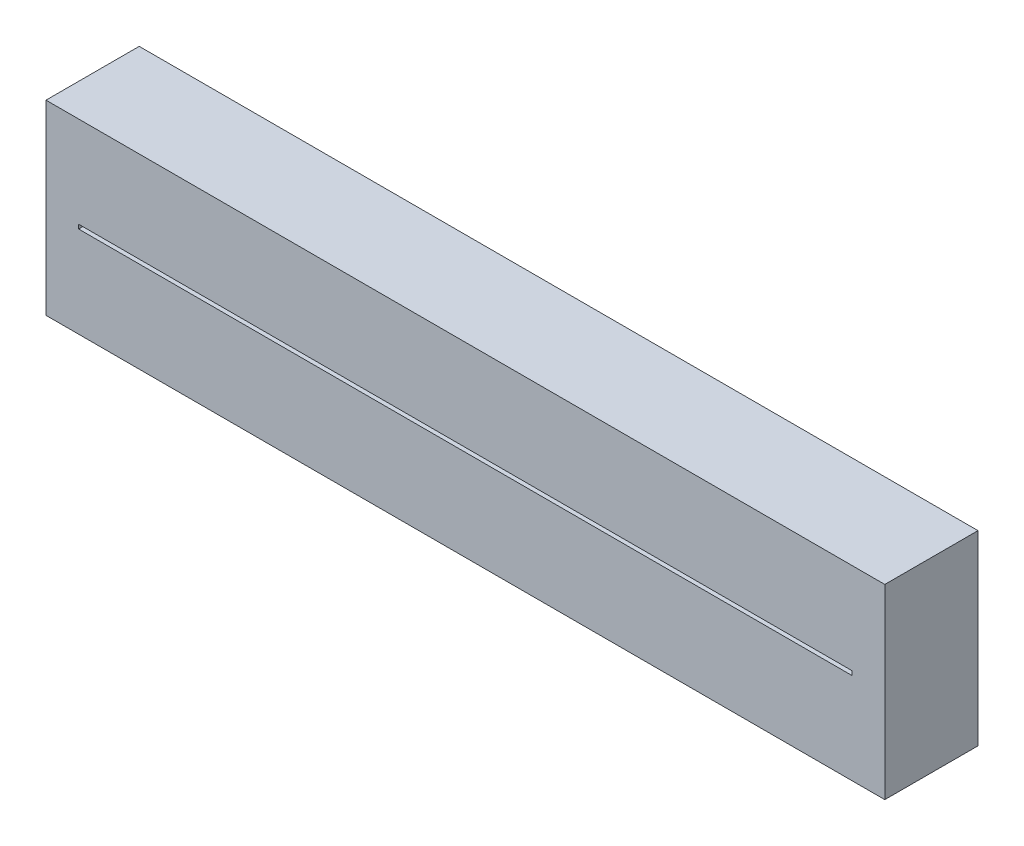
from build123d import *

# Parameters (mm, degrees)
SKETCH1_W           = 90
SKETCH1_H           = 20
BOSS_EXTRUDE1_DEPTH = 10
SKETCH2_W           = 83
SKETCH2_H           = 0.45
CUT_EXTRUDE1_DEPTH  = 5


with BuildPart() as part:
    # Sketch1 → Boss-Extrude1 (new body)
    with BuildSketch(Plane.XY):
        Rectangle(SKETCH1_W, SKETCH1_H)
    extrude(amount=BOSS_EXTRUDE1_DEPTH)

    # Sketch2 → Cut-Extrude1 (cut)
    with BuildSketch(Plane.XY.offset(10)):
        Rectangle(SKETCH2_W, SKETCH2_H)
    extrude(amount=-CUT_EXTRUDE1_DEPTH, mode=Mode.SUBTRACT)


solid = part.part
